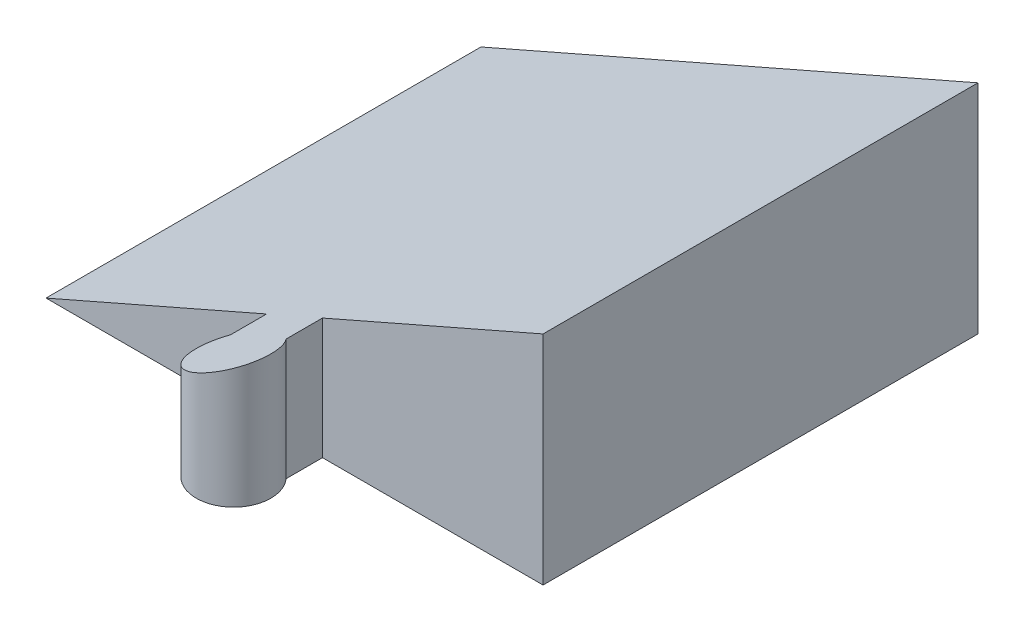
from build123d import *

# Parameters (mm, degrees)
RESSALTO_EXTRUS_O1_DEPTH = 70
RESSALTO_EXTRUS_O2_REACH = 92.865


with BuildPart() as part:
    # Esboço1 → Ressalto-extrusão1 (new body)
    with BuildSketch(Plane.XY):
        Polygon((-46.166666667, -15.652777778), (33.833333333, 19.347222222), (33.833333333, -15.652777778), align=None)
    extrude(amount=RESSALTO_EXTRUS_O1_DEPTH)

    # Ressalto-extrusão2: up to this plane
    ressalto_extrus_o2_end = Plane(origin=(-46.166666667, -15.652777778, 70), z_dir=(0.4008188340197078, -0.9161573349021892, 0))
    # Esboço3 → Ressalto-extrusão2 (add, up to the surface)
    with BuildSketch(Plane.XZ.offset(15.652777778), mode=Mode.PRIVATE) as ressalto_extrus_o2_sk1:
        with BuildLine():
            Line((-10.666666667, 70), (-1.666666667, 70))
            Line((-1.666666667, 70), (-1.666666667, 75.846688069))
            ThreePointArc((-1.666666667, 75.846688069), (-6.166666667, 85.815315035), (-10.666666667, 75.846688069))
            Line((-10.666666667, 75.846688069), (-10.666666667, 70))
        make_face()
    ressalto_extrus_o2_tool1 = split(extrude(ressalto_extrus_o2_sk1.sketch, amount=-RESSALTO_EXTRUS_O2_REACH, mode=Mode.PRIVATE), bisect_by=ressalto_extrus_o2_end, keep=Keep.BOTH, mode=Mode.PRIVATE)
    add(ressalto_extrus_o2_tool1.solids().sort_by_distance((-6.166667, -15.652778, 77.842662))[0])


solid = part.part
